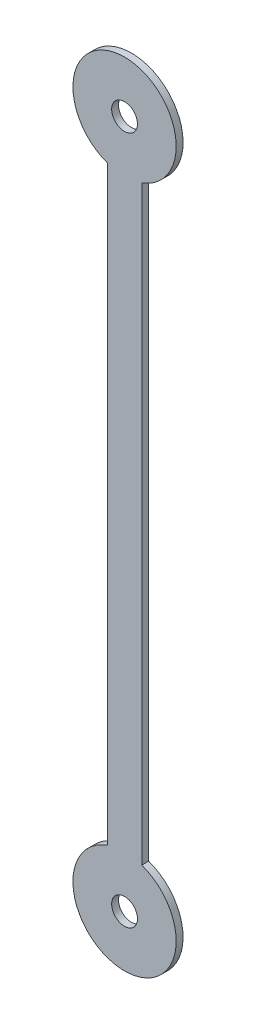
from build123d import *

# Parameters (mm, degrees)
SKETCH1_R           = 0.375
BOSS_EXTRUDE1_DEPTH = 0.1


with BuildPart() as part:
    # Sketch1 → Boss-Extrude1 (new, symmetric)
    with BuildSketch(Plane.XY):
        with BuildLine():
            Line((-0.5, 8.585786438), (-0.5, -8.585786438))
            ThreePointArc((-0.5, -8.585786438), (0, -11.5), (0.5, -8.585786438))
            Line((0.5, -8.585786438), (0.5, 8.585786438))
            ThreePointArc((0.5, 8.585786438), (0, 11.5), (-0.5, 8.585786438))
        make_face()
        with Locations((0, 10)):
            Circle(SKETCH1_R, mode=Mode.SUBTRACT)
        with Locations((0, -10)):
            Circle(SKETCH1_R, mode=Mode.SUBTRACT)
    extrude(amount=BOSS_EXTRUDE1_DEPTH, both=True)


solid = part.part
